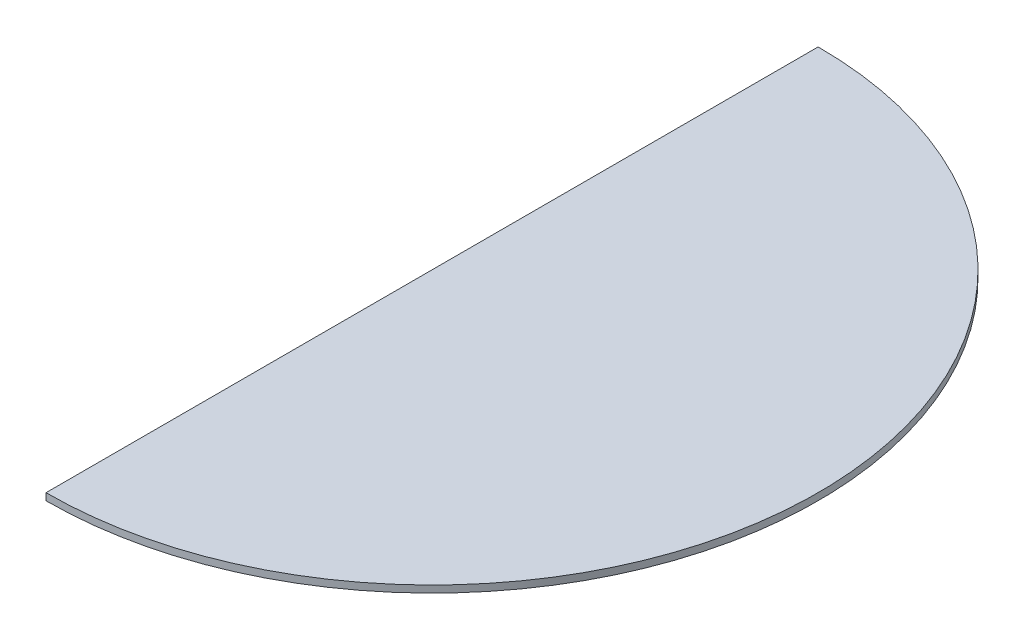
from build123d import *

# Parameters (mm, degrees)
BOSS_EXTRU_1_DEPTH = 20


with BuildPart() as part:
    # Esquisse2 → Boss.-Extru.1 (new body)
    with BuildSketch(Plane(origin=(0, 0, 0), x_dir=(1, 0, 0), z_dir=(0, 1, 0))):
        with BuildLine():
            Line((0, 1100), (0, 0))
            Line((0, 0), (0, -1100))
            ThreePointArc((0, -1100), (1100, 0), (0, 1100))
        make_face()
    extrude(amount=BOSS_EXTRU_1_DEPTH)


solid = part.part
